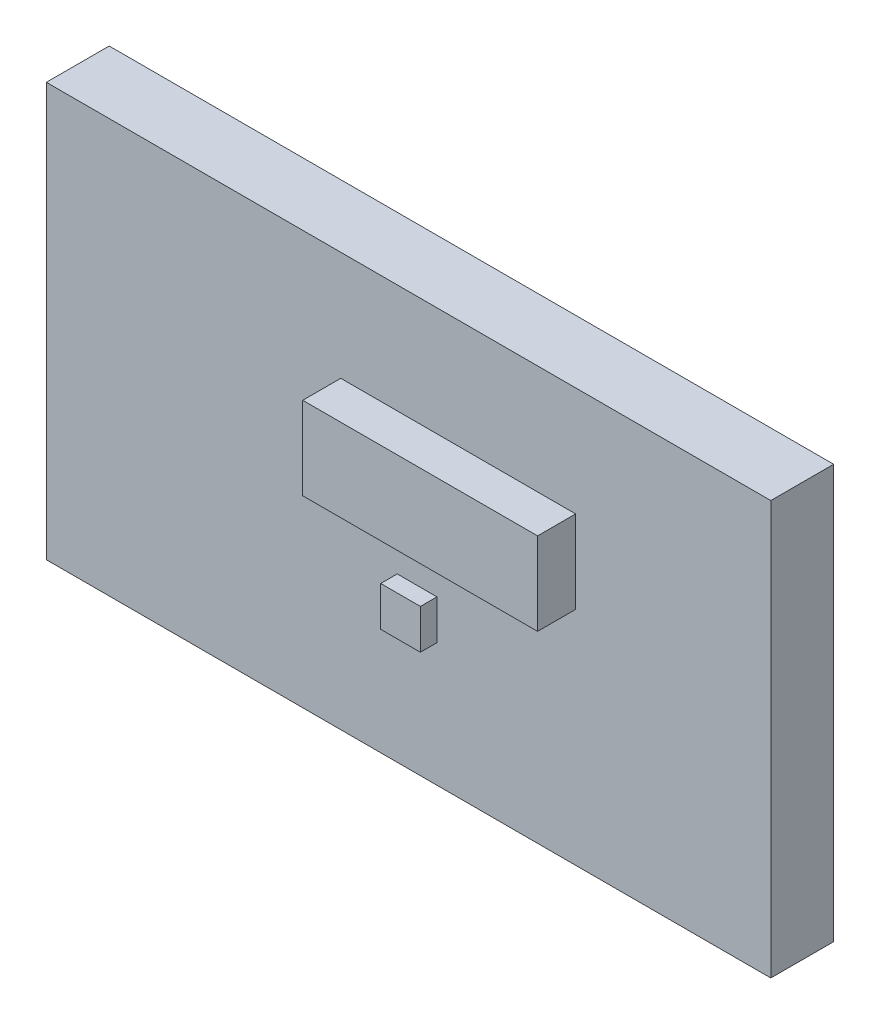
from build123d import *

# Parameters (mm, degrees)
ESQUISSE1_W        = 219
ESQUISSE1_H        = 125
BOSS_EXTRU_1_DEPTH = 19
ESQUISSE2_W        = 71
ESQUISSE2_H        = 25
BOSS_EXTRU_2_DEPTH = 11.5
ESQUISSE3_W        = 12
ESQUISSE3_H        = 12
BOSS_EXTRU_3_DEPTH = 5


with BuildPart() as part:
    # Esquisse1 → Boss.-Extru.1 (new body)
    with BuildSketch(Plane.XY):
        with Locations((109.5, 62.5)):
            Rectangle(ESQUISSE1_W, ESQUISSE1_H)
    extrude(amount=BOSS_EXTRU_1_DEPTH)

    # Esquisse2 → Boss.-Extru.2 (add)
    with BuildSketch(Plane.XY.offset(19)):
        with Locations((124.5, 79.5)):
            Rectangle(ESQUISSE2_W, ESQUISSE2_H)
    extrude(amount=BOSS_EXTRU_2_DEPTH)

    # Esquisse3 → Boss.-Extru.3 (add)
    with BuildSketch(Plane.XY.offset(19)):
        with Locations((112.07334821, 43.322122936)):
            Rectangle(ESQUISSE3_W, ESQUISSE3_H)
    extrude(amount=BOSS_EXTRU_3_DEPTH)


solid = part.part
